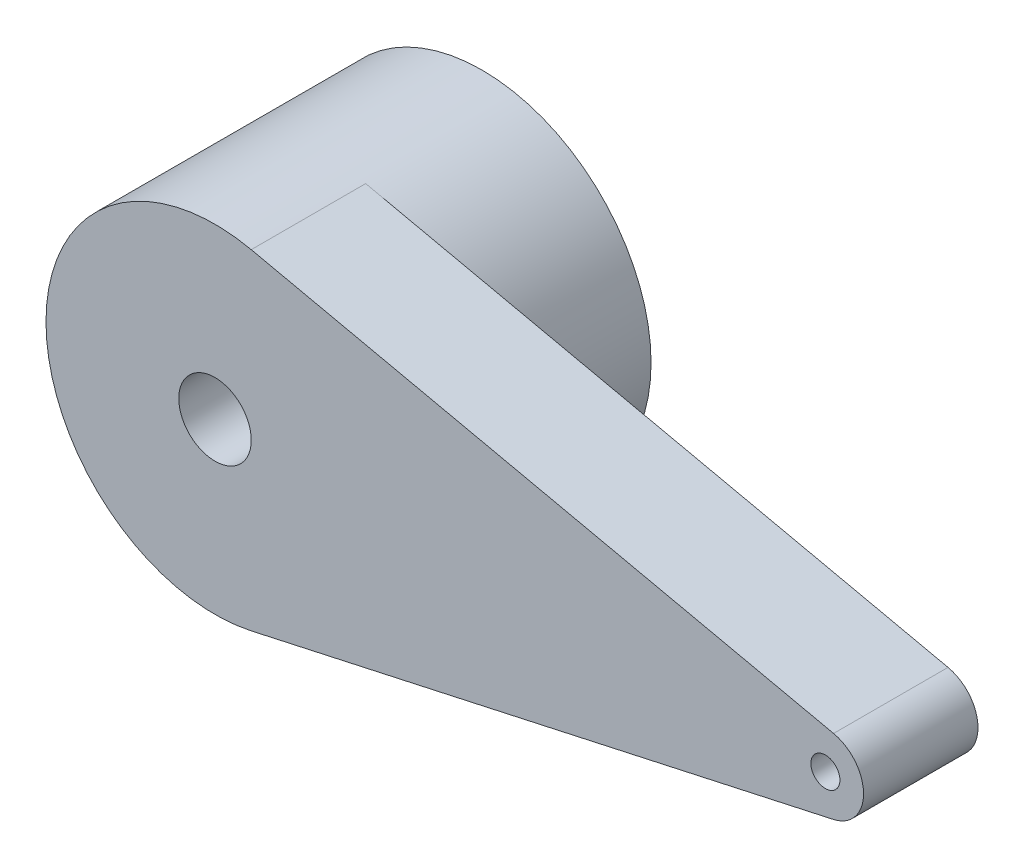
from build123d import *

# Parameters (mm, degrees)
SKETCH1_R           = 0.95
SKETCH1_R_2         = 0.381
BOSS_EXTRUDE1_DEPTH = 3
BOSS_EXTRUDE2_START = 4
SKETCH2_R           = 4.43
SKETCH2_R_2         = 2.43
BOSS_EXTRUDE2_DEPTH = 4


with BuildPart() as part:
    # Sketch1 → Boss-Extrude1 (new body)
    with BuildSketch(Plane.XY):
        with BuildLine():
            Line((0.94968125, 4.327008843), (16.214375, 0.976751432))
            ThreePointArc((16.214375, 0.976751432), (17, 0), (16.214375, -0.976751432))
            Line((16.214375, -0.976751432), (0.94968125, -4.327008843))
            ThreePointArc((0.94968125, -4.327008843), (-4.43, 0), (0.94968125, 4.327008843))
        make_face()
        Circle(SKETCH1_R, mode=Mode.SUBTRACT)
        with Locations((16, 0)):
            Circle(SKETCH1_R_2, mode=Mode.SUBTRACT)
    extrude(amount=BOSS_EXTRUDE1_DEPTH)

    # Sketch2 → Boss-Extrude2 (add)
    with BuildSketch(Plane(origin=(0, 0, 0), x_dir=(-1, 0, 0), z_dir=(0, 0, -1)).offset(BOSS_EXTRUDE2_START)):
        Circle(SKETCH2_R)
        Circle(SKETCH2_R_2, mode=Mode.SUBTRACT)
    extrude(amount=-BOSS_EXTRUDE2_DEPTH)


solid = part.part
